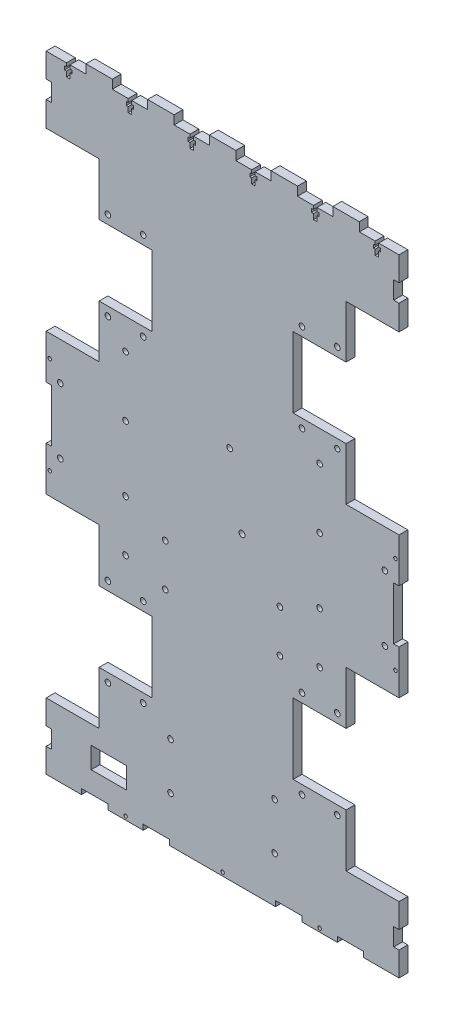
from build123d import *

# Parameters (mm, degrees)
EXTRUDE_1_DEPTH            = 5
SKETCH_5_R                 = 1.6
CUT_EXTRUDE_1_DEPTH        = 329.148213465
SKETCH_6_W                 = 3
SKETCH_6_H                 = 30
CUT_EXTRUDE_2_DEPTH        = 329.148213465
SKETCH_7_W                 = 3
SKETCH_7_H                 = 10
CUT_EXTRUDE_3_DEPTH        = 329.148213465
SKETCH_8_W                 = 15
SKETCH_8_H                 = 3
CUT_EXTRUDE_4_DEPTH        = 329.148213465
SKETCH_9_W                 = 30
SKETCH_9_H                 = 0.36
EXTRUDE_2_DEPTH            = 5
SKETCH_10_R                = 1.6
SKETCH_10_R_2              = 1.5
SKETCH_10_W                = 30
SKETCH_10_H                = 40
CUT_EXTRUDE_6145_DEPTH     = 329.148213465
SKETCH_11_W                = 80
SKETCH_11_H                = 219.82
EXTRUDE_3_DEPTH            = 5
SKETCH_12_W                = 15
SKETCH_12_H                = 5
EXTRUDE_4_DEPTH            = 5
CUT_EXTRUDE_6_DEPTH        = 333.236737884
PATTERN_LINEAR_1_COUNT     = 5
PATTERN_LINEAR_1_PITCH     = 35
PATTERN_LINEAR_1_COL_COUNT = 2
PATTERN_LINEAR_1_COL_PITCH = 35
SKETCH_15_R                = 1
CUT_EXTRUDE_8_DEPTH        = 333.236737884
SKETCH_16_R                = 1
CUT_EXTRUDE_9_DEPTH        = 333.236737884
SKETCH_18_R                = 1.6
SKETCH_18_R_2              = 1.7
CUT_EXTRUDE_11084_DEPTH    = 333.236737884
SKETCH_20_R                = 1.6
CUT_EXTRUDE_11_DEPTH       = 333.236737884
SKETCH_23_R                = 1.6
CUT_EXTRUDE_14238_DEPTH    = 333.236737884
SKETCH_25_R                = 1.6
CUT_EXTRUDE_15434_DEPTH    = 333.236737884
SKETCH_26_R                = 1.6
CUT_EXTRUDE_16213_DEPTH    = 333.236737884
SKETCH_27_W                = 20
SKETCH_27_H                = 12
CUT_EXTRUDE_16852_DEPTH    = 333.236737884


with BuildPart() as part:
    # 草图3 → 凸台-拉伸1 (new body)
    with BuildSketch(Plane.XY):
        Polygon((-10, 267.5), (190, 267.5), (190, 230), (160, 230), (160, 130), (190, 130), (190, 50), (160, 50), (160, -50), (190, -50), (190, -87.5), (-10, -87.5), (-10, -50), (20, -50), (20, 50), (-10, 50), (-10, 130), (20, 130), (20, 230), (-10, 230), align=None)
    extrude(amount=EXTRUDE_1_DEPTH)

    # 草图5 → 切除-拉伸1 (cut, through all)
    with BuildSketch(Plane.XY.offset(5)):
        with Locations((33, 195)):
            Circle(SKETCH_5_R)
        with Locations((57, 195)):
            Circle(SKETCH_5_R)
        with Locations((33, 165)):
            Circle(SKETCH_5_R)
        with Locations((57, 165)):
            Circle(SKETCH_5_R)
        with Locations((123, 195)):
            Circle(SKETCH_5_R)
        with Locations((147, 195)):
            Circle(SKETCH_5_R)
        with Locations((123, 165)):
            Circle(SKETCH_5_R)
        with Locations((147, 165)):
            Circle(SKETCH_5_R)
        with Locations((33, 15)):
            Circle(SKETCH_5_R)
        with Locations((57, 15)):
            Circle(SKETCH_5_R)
        with Locations((33, -15)):
            Circle(SKETCH_5_R)
        with Locations((57, -15)):
            Circle(SKETCH_5_R)
        with Locations((123, 15)):
            Circle(SKETCH_5_R)
        with Locations((147, 15)):
            Circle(SKETCH_5_R)
        with Locations((123, -15)):
            Circle(SKETCH_5_R)
        with Locations((147, -15)):
            Circle(SKETCH_5_R)
    extrude(amount=-CUT_EXTRUDE_1_DEPTH, mode=Mode.SUBTRACT)

    # 草图6 → 切除-拉伸2 (cut, through all)
    with BuildSketch(Plane.XY.offset(5)):
        with Locations((-8.5, 90)):
            Rectangle(SKETCH_6_W, SKETCH_6_H)
        with Locations((188.5, 90)):
            Rectangle(SKETCH_6_W, SKETCH_6_H)
    extrude(amount=-CUT_EXTRUDE_2_DEPTH, mode=Mode.SUBTRACT)

    # 草图7 → 切除-拉伸3 (cut, through all)
    with BuildSketch(Plane.XY.offset(5)):
        with Locations((-8.5, 248.75)):
            Rectangle(SKETCH_7_W, SKETCH_7_H)
        with Locations((188.5, 248.75)):
            Rectangle(SKETCH_7_W, SKETCH_7_H)
        with Locations((-8.5, -68.75)):
            Rectangle(SKETCH_7_W, SKETCH_7_H)
        with Locations((188.5, -68.75)):
            Rectangle(SKETCH_7_W, SKETCH_7_H)
    extrude(amount=-CUT_EXTRUDE_3_DEPTH, mode=Mode.SUBTRACT)

    # 草图8 → 切除-拉伸4 (cut, through all)
    with BuildSketch(Plane.XY.offset(5)):
        with Locations((17.5, -86)):
            Rectangle(SKETCH_8_W, SKETCH_8_H)
        with Locations((52.5, -86)):
            Rectangle(SKETCH_8_W, SKETCH_8_H)
        with Locations((127.5, -86)):
            Rectangle(SKETCH_8_W, SKETCH_8_H)
        with Locations((162.5, -86)):
            Rectangle(SKETCH_8_W, SKETCH_8_H)
    extrude(amount=-CUT_EXTRUDE_4_DEPTH, mode=Mode.SUBTRACT)

    # 草图9 → 凸台-拉伸2 (add)
    with BuildSketch(Plane.XY.offset(5)):
        with Locations((5, 229.82)):
            Rectangle(SKETCH_9_W, SKETCH_9_H)
        with Locations((175, 229.82)):
            Rectangle(SKETCH_9_W, SKETCH_9_H)
    extrude(amount=-EXTRUDE_2_DEPTH)

    # 草图10 → Cut-Extrude 6145 (cut, through all)
    with BuildSketch(Plane(origin=(0, 0, 0), x_dir=(-1, 0, 0), z_dir=(0, 0, -1))):
        with Locations((-25, 204.82)):
            Circle(SKETCH_10_R)
        with Locations((-25, 154.82)):
            Circle(SKETCH_10_R)
        with Locations((-25, 25)):
            Circle(SKETCH_10_R)
        with Locations((-25, -25)):
            Circle(SKETCH_10_R)
        with Locations((-155, 204.82)):
            Circle(SKETCH_10_R)
        with Locations((-155, 154.82)):
            Circle(SKETCH_10_R_2)
        with Locations((-155, 25)):
            Circle(SKETCH_10_R)
        with Locations((-155, -25)):
            Circle(SKETCH_10_R)
        with Locations((-135, 204.82)):
            Circle(SKETCH_10_R)
        with Locations((-135, 154.82)):
            Circle(SKETCH_10_R)
        with Locations((-135, 25)):
            Circle(SKETCH_10_R)
        with Locations((-45, 204.82)):
            Circle(SKETCH_10_R)
        with Locations((-45, 154.82)):
            Circle(SKETCH_10_R)
        with Locations((-45, 25)):
            Circle(SKETCH_10_R)
        with Locations((-45, -25)):
            Circle(SKETCH_10_R)
        with Locations((-135, -25)):
            Circle(SKETCH_10_R)
        with Locations((-145, 179.82)):
            Rectangle(SKETCH_10_W, SKETCH_10_H)
        with Locations((-35, 179.82)):
            Rectangle(SKETCH_10_W, SKETCH_10_H)
        with Locations((-35, 0)):
            Rectangle(SKETCH_10_W, SKETCH_10_H)
        with Locations((-145, 0)):
            Rectangle(SKETCH_10_W, SKETCH_10_H)
    extrude(amount=-CUT_EXTRUDE_6145_DEPTH, mode=Mode.SUBTRACT)

    # 草图11 → 凸台-拉伸3 (add)
    with BuildSketch(Plane(origin=(0, 0, 0), x_dir=(-1, 0, 0), z_dir=(0, 0, -1))):
        with Locations((-90, 89.91)):
            Rectangle(SKETCH_11_W, SKETCH_11_H)
    extrude(amount=-EXTRUDE_3_DEPTH)

    # 草图12 → 凸台-拉伸4 (add)
    with BuildSketch(Plane(origin=(0, 0, 0), x_dir=(-1, 0, 0), z_dir=(0, 0, -1))):
        with Locations((-90, 270)):
            Rectangle(SKETCH_12_W, SKETCH_12_H)
        with Locations((-55, 270)):
            Rectangle(SKETCH_12_W, SKETCH_12_H)
        with Locations((-20, 270)):
            Rectangle(SKETCH_12_W, SKETCH_12_H)
        with Locations((-125, 270)):
            Rectangle(SKETCH_12_W, SKETCH_12_H)
        with Locations((-160, 270)):
            Rectangle(SKETCH_12_W, SKETCH_12_H)
    extrude(amount=-EXTRUDE_4_DEPTH)

    # 草图13 → 切除-拉伸6 (cut, through all)
    with BuildSketch(Plane(origin=(0, 0, 0), x_dir=(-1, 0, 0), z_dir=(0, 0, -1))):
        Polygon((-143.5, 267.5), (-141.5, 267.5), (-141.5, 265.5), (-140.45, 265.5), (-140.45, 263.5), (-141.5, 263.5), (-141.5, 260.5), (-143.5, 260.5), (-143.5, 263.5), (-144.55, 263.5), (-144.55, 265.5), (-143.5, 265.5), align=None)
    cut_extrude_6 = extrude(amount=-CUT_EXTRUDE_6_DEPTH, mode=Mode.SUBTRACT)

    # 阵列(线性)1: 切除-拉伸6 ×5
    with Locations(*[(-i * PATTERN_LINEAR_1_PITCH, 0, 0) for i in range(1, PATTERN_LINEAR_1_COUNT)]):
        add(cut_extrude_6, mode=Mode.SUBTRACT)

    # 阵列(线性)1 col: 切除-拉伸6 ×2
    with Locations(*[(i * PATTERN_LINEAR_1_COL_PITCH, 0, 0) for i in range(1, PATTERN_LINEAR_1_COL_COUNT)]):
        add(cut_extrude_6, mode=Mode.SUBTRACT)

    # 草图15 → 切除-拉伸8 (cut, through all)
    with BuildSketch(Plane.XY.offset(5)):
        with Locations((90, -85.5)):
            Circle(SKETCH_15_R)
        with Locations((145, -85.5)):
            Circle(SKETCH_15_R)
        with Locations((35, -85.5)):
            Circle(SKETCH_15_R)
    extrude(amount=-CUT_EXTRUDE_8_DEPTH, mode=Mode.SUBTRACT)

    # 草图16 → 切除-拉伸9 (cut, through all)
    with BuildSketch(Plane.XY.offset(5)):
        with Locations((188, 62.5)):
            Circle(SKETCH_16_R)
        with Locations((188, 117.403493516)):
            Circle(SKETCH_16_R)
        with Locations((-8, 62.5)):
            Circle(SKETCH_16_R)
        with Locations((-8, 117.5)):
            Circle(SKETCH_16_R)
    extrude(amount=-CUT_EXTRUDE_9_DEPTH, mode=Mode.SUBTRACT)

    # 草图18 → Cut-Extrude 11084 (cut, through all)
    with BuildSketch(Plane.XY.offset(5)):
        with Locations((94, 124.6)):
            Circle(SKETCH_18_R)
        with Locations((101, 86)):
            Circle(SKETCH_18_R_2)
    extrude(amount=-CUT_EXTRUDE_11084_DEPTH, mode=Mode.SUBTRACT)

    # 草图20 → 切除-拉伸11 (cut, through all)
    with BuildSketch(Plane.XY.offset(5)):
        with Locations((182, 71.5)):
            Circle(SKETCH_20_R)
        with Locations((145, 108.5)):
            Circle(SKETCH_20_R)
        with Locations((145, 71.5)):
            Circle(SKETCH_20_R)
        with Locations((182, 108.5)):
            Circle(SKETCH_20_R)
        with Locations((35, 71.5)):
            Circle(SKETCH_20_R)
        with Locations((-2, 108.5)):
            Circle(SKETCH_20_R)
        with Locations((-2, 71.5)):
            Circle(SKETCH_20_R)
        with Locations((35, 108.5)):
            Circle(SKETCH_20_R)
    extrude(amount=-CUT_EXTRUDE_11_DEPTH, mode=Mode.SUBTRACT)

    # 草图23 → Cut-Extrude 14238 (cut, through all)
    with BuildSketch(Plane.XY.offset(5)):
        with Locations((119.5, -61.5)):
            Circle(SKETCH_23_R)
        with Locations((60.5, -61.5)):
            Circle(SKETCH_23_R)
        with Locations((119.5, -35)):
            Circle(SKETCH_23_R)
        with Locations((60.5, -35)):
            Circle(SKETCH_23_R)
    extrude(amount=-CUT_EXTRUDE_14238_DEPTH, mode=Mode.SUBTRACT)

    # 草图25 → Cut-Extrude 15434 (cut, through all)
    with BuildSketch(Plane.XY.offset(5)):
        with Locations((122.5, 37)):
            Circle(SKETCH_25_R)
        with Locations((57.5, 37)):
            Circle(SKETCH_25_R)
        with Locations((122.5, 61)):
            Circle(SKETCH_25_R)
        with Locations((57.5, 61)):
            Circle(SKETCH_25_R)
    extrude(amount=-CUT_EXTRUDE_15434_DEPTH, mode=Mode.SUBTRACT)

    # 草图26 → Cut-Extrude 16213 (cut, through all)
    with BuildSketch(Plane.XY.offset(5)):
        with Locations((145, 42.5)):
            Circle(SKETCH_26_R)
        with Locations((35, 142.5)):
            Circle(SKETCH_26_R)
        with Locations((145, 142.5)):
            Circle(SKETCH_26_R)
        with Locations((35, 42.5)):
            Circle(SKETCH_26_R)
    extrude(amount=-CUT_EXTRUDE_16213_DEPTH, mode=Mode.SUBTRACT)

    # 草图27 → Cut-Extrude 16852 (cut, through all)
    with BuildSketch(Plane.XY.offset(5)):
        with Locations((25.5, -66.5)):
            Rectangle(SKETCH_27_W, SKETCH_27_H)
    extrude(amount=-CUT_EXTRUDE_16852_DEPTH, mode=Mode.SUBTRACT)


solid = part.part
